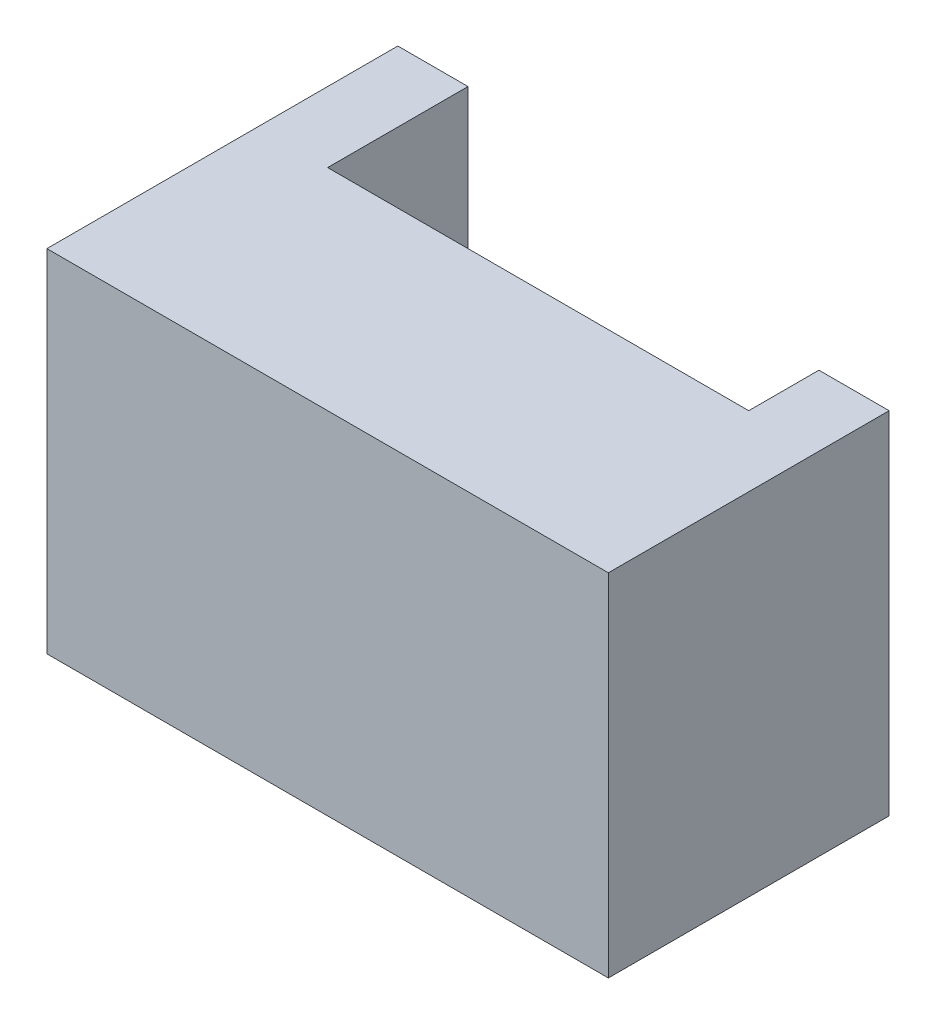
from build123d import *

# Parameters (mm, degrees)
BOSS_EXTRUDE1_DEPTH = 100


with BuildPart() as part:
    # Sketch1 → Boss-Extrude1 (new body)
    with BuildSketch(Plane(origin=(0, 0, 0), x_dir=(1, 0, 0), z_dir=(0, 1, 0))):
        Polygon((-81.27388535, 35.414012739), (-61.27388535, 35.414012739), (-61.27388535, -4.585987261), (58.72611465, -4.585987261), (58.72611465, 15.414012739), (78.72611465, 15.414012739), (78.72611465, -64.585987261), (-81.27388535, -64.585987261), align=None)
    extrude(amount=BOSS_EXTRUDE1_DEPTH)


solid = part.part
